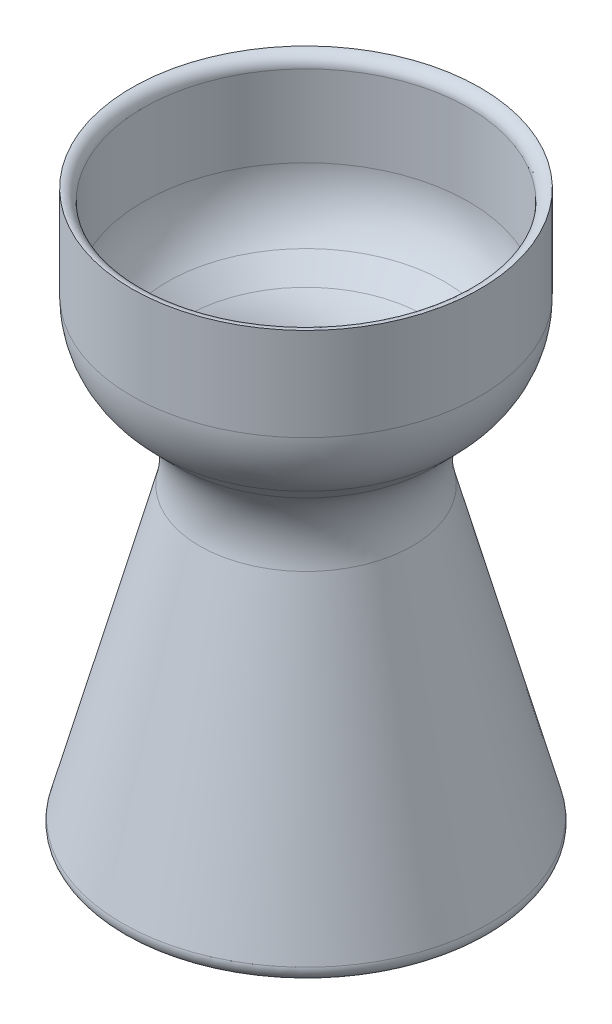
from build123d import *


with BuildPart() as part:
    # Sketch1 → Revolve1 (revolve)
    with BuildSketch(Plane.XY, mode=Mode.PRIVATE) as revolve1_sk:
        with BuildLine():
            Line((47.9298, 0), (25.998784012, 81.847665928))
            ThreePointArc((25.998784012, 81.847665928), (25.998784012, 94.995673419), (32.572787758, 106.382181916))
            Line((32.572787758, 106.382181916), (37.940448212, 111.74984237))
            ThreePointArc((37.940448212, 111.74984237), (42.75822261, 118.960151297), (44.45, 127.465290581))
            Line((44.45, 127.465290581), (44.45, 149.690290581))
            ThreePointArc((44.45, 149.690290581), (45.37993597, 151.935354612), (47.625, 152.865290581))
            Line((47.625, 152.865290581), (47.625, 127.465290581))
            ThreePointArc((47.625, 127.465290581), (45.691540126, 117.745131399), (40.185512242, 109.504778339))
            Line((40.185512242, 109.504778339), (34.817851788, 104.137117885))
            ThreePointArc((34.817851788, 104.137117885), (29.065598511, 94.173922951), (29.065598511, 82.669416396))
            Line((29.065598511, 82.669416396), (50.17486403, 3.888564967))
            ThreePointArc((50.17486403, 3.888564967), (49.857680189, 1.479314498), (47.9298, 0))
        make_face()
    revolve(revolve1_sk.sketch.rotate(Axis((0, 0, 0), (0, 1, 0)), 90), axis=Axis((0, 0, 0), (0, 1, 0)))


solid = part.part
